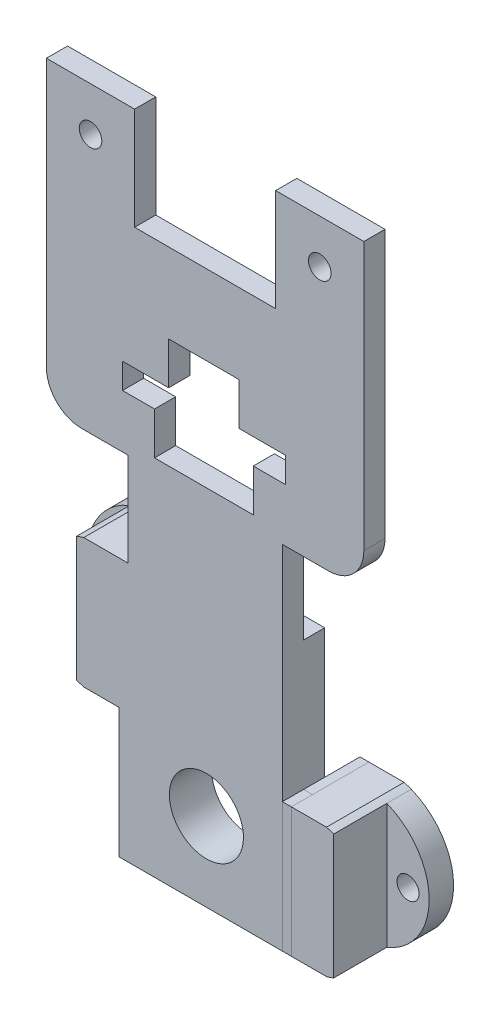
from build123d import *

# Parameters (mm, degrees)
BOSS_EXTRUDE1_DEPTH      = 17.806228865
BOSS_EXTRUDE2_DEPTH      = 3
SKETCH5_W                = 21.9
SKETCH5_H                = 3
BOSS_EXTRUDE3_DEPTH      = 37
CUT_EXTRUDE1_REACH       = 1273.855
SKETCH7_R                = 5.25
SKETCH8_W                = 3
SKETCH8_H                = 36.7
BOSS_EXTRUDE4_DEPTH      = 1.27
SKETCH9_W                = 3
SKETCH9_H                = 18.35
BOSS_EXTRUDE5_DEPTH      = 6
SKETCH11_W               = 6
SKETCH11_H               = 18.35
BOSS_EXTRUDE6_DEPTH      = 8
SKETCH12_W               = 6
SKETCH12_H               = 18.35
BOSS_EXTRUDE7_DEPTH      = 6
SKETCH14_R               = 1.5625
CUT_EXTRUDE2_DEPTH       = 1272.783249002
CUT_EXTRUDE3_DEPTH       = 1272.855217677
SKETCH17_R               = 1.6
CUT_EXTRUDE4_DEPTH       = 1272.855217677
SKETCH18_R               = 2.5
CUT_EXTRUDE5_DEPTH       = 3
FILLET8_R                = 2
SKETCH19_W               = 3
SKETCH19_H               = 18.35
BOSS_EXTRUDE9_DEPTH      = 1.27
SKETCH20_W               = 6
SKETCH20_H               = 18.35
BOSS_EXTRUDE10_DEPTH     = 11
SKETCH21_W               = 6
SKETCH21_H               = 18.35
BOSS_EXTRUDE12_DEPTH     = 6
SKETCH22_R               = 1.565
CUT_EXTRUDE6_DEPTH       = 1274.354061352
CUT_EXTRUDE7_DEPTH       = 1274.354061352
CUT_EXTRUDE7_DEPTH_BACK  = 1274.354061352
CUT_EXTRUDE11_DEPTH      = 1272.593907123
CUT_EXTRUDE11_DEPTH_BACK = 1272.593907123
SKETCH29_W               = 17.806228865
SKETCH29_H               = 21.127306801
CUT_EXTRUDE12_DEPTH      = 1271.750455843
CUT_EXTRUDE12_DEPTH_BACK = 1271.750455843
SKETCH30_W               = 45
SKETCH30_H               = 36.649004673
BOSS_EXTRUDE14_DEPTH     = 3
CUT_EXTRUDE13_DEPTH      = 1274.303470735
CUT_EXTRUDE13_DEPTH_BACK = 1274.303470735
CUT_EXTRUDE15_DEPTH      = 1274.303470735
CUT_EXTRUDE15_DEPTH_BACK = 1274.303470735
SKETCH35_W               = 20
SKETCH35_H               = 14.5
CUT_EXTRUDE16_DEPTH      = 1274.303470735
CUT_EXTRUDE16_DEPTH_BACK = 1274.303470735
SKETCH36_R               = 1.6
SKETCH37_W               = 21.9
SKETCH37_H               = 36.7
BOSS_EXTRUDE16_DEPTH     = 3
CUT_EXTRUDE17_DEPTH      = 1274.281087814
CUT_EXTRUDE17_DEPTH_BACK = 1274.281087814
SKETCH38_R               = 5.25
SKETCH39_W               = 21.9
SKETCH39_H               = 8
BOSS_EXTRUDE17_DEPTH     = 3
SKETCH40_W               = 8
SKETCH40_H               = 18.35
BOSS_EXTRUDE19_DEPTH     = 1.27
SKETCH41_W               = 8
SKETCH41_H               = 18.35
BOSS_EXTRUDE20_DEPTH     = 1.27
SKETCH42_W               = 7.54
SKETCH42_H               = 18.35
CUT_EXTRUDE18_DEPTH      = 1272.443848437
SKETCH43_W               = 7.54
SKETCH43_H               = 18.35
CUT_EXTRUDE19_DEPTH      = 1272.443848437


with BuildPart() as part:
    # Sketch1 → Boss-Extrude1 (new body)
    with BuildSketch(Plane(origin=(0, 0, 1119.483697074), x_dir=(-1, 0, 0), z_dir=(0, 0, -1))):
        with BuildLine():
            Line((-1161.329927858, 505.6656047), (-1161.329927858, 518.1656047))
            Line((-1161.329927858, 518.1656047), (-1148.829927858, 518.1656047))
            Line((-1148.829927858, 518.1656047), (-1148.829927858, 505.6656047))
            add(Edge.make_bspline(
                [(-1148.829927858, 505.6656047), (-1142.163261192, 505.6656047), (-1135.496594525, 505.6656047), (-1128.829927858, 505.6656047)],
                knots=[0.277777778, 0.277777778, 0.277777778, 0.277777778, 0.722222222, 0.722222222, 0.722222222, 0.722222222], degree=3))
            Line((-1128.829927858, 505.6656047), (-1128.829927858, 518.1656047))
            Line((-1128.829927858, 518.1656047), (-1116.329927858, 518.1656047))
            Line((-1116.329927858, 518.1656047), (-1116.329927858, 505.6656047))
            ThreePointArc((-1116.329927858, 505.6656047), (-1138.829927858, 497.038297899), (-1161.329927858, 505.6656047))
        make_face()
    extrude(amount=BOSS_EXTRUDE1_DEPTH)

    # Sketch4 → Boss-Extrude2 (add)
    with BuildSketch(Plane(origin=(0, 0, 1101.677468208), x_dir=(-1, 0, 0), z_dir=(0, 0, -1))):
        with BuildLine():
            Line((-1149.779927858, 462.266600027), (-1149.779927858, 489.392833753))
            ThreePointArc((-1149.779927858, 489.392833753), (-1152.708860047, 496.463901565), (-1159.779927858, 499.392833753))
            Line((-1159.779927858, 499.392833753), (-1161.329927858, 499.392833753))
            Line((-1161.329927858, 499.392833753), (-1161.329927858, 511.9156047))
            Line((-1161.329927858, 511.9156047), (-1116.329927858, 511.9156047))
            Line((-1116.329927858, 511.9156047), (-1116.329927858, 499.392833753))
            Line((-1116.329927858, 499.392833753), (-1117.879927858, 499.392833753))
            ThreePointArc((-1117.879927858, 499.392833753), (-1124.95099567, 496.463901565), (-1127.879927858, 489.392833753))
            Line((-1127.879927858, 489.392833753), (-1127.879927858, 462.266600027))
            Line((-1127.879927858, 462.266600027), (-1149.779927858, 462.266600027))
        make_face()
    extrude(amount=BOSS_EXTRUDE2_DEPTH)

    # Sketch5 → Boss-Extrude3 (add)
    with BuildSketch(Plane.XZ.offset(-462.266600027)):
        with Locations((1138.829927858, 1100.177468208)):
            Rectangle(SKETCH5_W, SKETCH5_H)
    extrude(amount=BOSS_EXTRUDE3_DEPTH)

    # Sketch7 → Cut-Extrude1 (cut, up to next)
    with BuildSketch(Plane(origin=(0, 0, 1098.677468208), x_dir=(-1, 0, 0), z_dir=(0, 0, -1)), mode=Mode.PRIVATE) as cut_extrude1_sk1:
        with Locations(Location((-1139.009861583, 436.459083359, 0), (0, 0, 90))):
            Circle(SKETCH7_R)
    cut_extrude1_tool1 = extrude(cut_extrude1_sk1.sketch, amount=-CUT_EXTRUDE1_REACH, mode=Mode.PRIVATE) & part.part
    add(cut_extrude1_tool1.solids().sort_by_distance((1139.009862, 436.459083, 1098.677468))[0], mode=Mode.SUBTRACT)



with BuildPart() as body_2:
    # Sketch8 → Boss-Extrude4 (new body)
    with BuildSketch(Plane.ZY.offset(-1127.879927858)):
        with Locations((1100.177468208, 443.616600027)):
            Rectangle(SKETCH8_W, SKETCH8_H)
    extrude(amount=BOSS_EXTRUDE4_DEPTH)


with BuildPart() as part_1:
    add(part.part)

    add(body_2.part)  # Boss-Extrude5 merges body 2
    # Sketch9 → Boss-Extrude5 (add)
    with BuildSketch(Plane.ZY.offset(-1126.609927858)):
        with Locations((1100.177468208, 452.791600027)):
            Rectangle(SKETCH9_W, SKETCH9_H)
    extrude(amount=BOSS_EXTRUDE5_DEPTH)

    # Sketch11 → Boss-Extrude6 (add)
    with BuildSketch(Plane.XY.offset(1101.677468208)):
        with Locations((1123.609927858, 452.791600027)):
            Rectangle(SKETCH11_W, SKETCH11_H)
    extrude(amount=BOSS_EXTRUDE6_DEPTH)

    # Sketch12 → Boss-Extrude7 (add)
    with BuildSketch(Plane.ZY.offset(-1120.609927858)):
        with Locations((1106.677468208, 452.791600027)):
            Rectangle(SKETCH12_W, SKETCH12_H)
    extrude(amount=BOSS_EXTRUDE7_DEPTH)

    # Sketch14 → Cut-Extrude2 (cut, through all)
    with BuildSketch(Plane(origin=(0, 0, 1103.677468208), x_dir=(-1, 0, 0), z_dir=(0, 0, -1))):
        with Locations((-1117.609927858, 452.791600027)):
            Circle(SKETCH14_R)
    extrude(amount=-CUT_EXTRUDE2_DEPTH, mode=Mode.SUBTRACT)

    # Sketch16 → Cut-Extrude3 (cut, through all)
    with BuildSketch(Plane(origin=(0, 0, 1098.677468208), x_dir=(-1, 0, 0), z_dir=(0, 0, -1))):
        with BuildLine():
            Line((-1126.609927858, 461.966600027), (-1126.609927858, 463.878724732))
            Line((-1126.609927858, 463.878724732), (-1111.609927858, 463.878724732))
            Line((-1111.609927858, 463.878724732), (-1111.609927858, 441.878724732))
            Line((-1111.609927858, 441.878724732), (-1126.609927858, 441.878724732))
            Line((-1126.609927858, 441.878724732), (-1126.609927858, 443.616600027))
            ThreePointArc((-1126.609927858, 443.616600027), (-1114.609927858, 452.791600027), (-1126.609927858, 461.966600027))
        make_face()
    extrude(amount=-CUT_EXTRUDE3_DEPTH, mode=Mode.SUBTRACT)

    # Sketch17 → Cut-Extrude4 (cut, through all)
    with BuildSketch(Plane(origin=(0, 0, 1098.677468208), x_dir=(-1, 0, 0), z_dir=(0, 0, -1))):
        with Locations(Location((-1122.579927858, 511.9156047, 0), (0, 0, 90))):
            Circle(SKETCH17_R)
        with Locations(Location((-1155.079927858, 511.9156047, 0), (0, 0, 90))):
            Circle(SKETCH17_R)
    extrude(amount=-CUT_EXTRUDE4_DEPTH, mode=Mode.SUBTRACT)

    # Sketch18 → Cut-Extrude5 (cut)
    with BuildSketch(Plane(origin=(0, 0, 1098.677468208), x_dir=(-1, 0, 0), z_dir=(0, 0, -1))):
        with Locations((-1155.079927858, 511.9156047)):
            Circle(SKETCH18_R)
        with Locations((-1122.579927858, 511.9156047)):
            Circle(SKETCH18_R)
    extrude(amount=-CUT_EXTRUDE5_DEPTH, mode=Mode.SUBTRACT)

    # Fillet8
    fillet8_edges = [part_1.edges().sort_by_distance(p)[0] for p in [
        (1138.829927858, 505.6656047, 1119.483697074),
    ]]
    fillet(fillet8_edges, radius=FILLET8_R)


with BuildPart() as body_2_2:
    # Sketch19 → Boss-Extrude9 (new body)
    with BuildSketch(Plane(origin=(1149.779927858, 0, 0), x_dir=(0, 0, -1), z_dir=(1, 0, 0))):
        with Locations((-1100.177468208, 434.441600027)):
            Rectangle(SKETCH19_W, SKETCH19_H)
    extrude(amount=BOSS_EXTRUDE9_DEPTH)


with BuildPart() as body_3:
    # Sketch20 → Boss-Extrude10 (new body)
    with BuildSketch(Plane(origin=(0, 0, 1098.677468208), x_dir=(-1, 0, 0), z_dir=(0, 0, -1))):
        with Locations((-1154.049927858, 434.441600027)):
            Rectangle(SKETCH20_W, SKETCH20_H)
    extrude(amount=-BOSS_EXTRUDE10_DEPTH)


with BuildPart() as body_4:
    # Sketch21 → Boss-Extrude12 (new body)
    with BuildSketch(Plane(origin=(1157.049927858, 0, 0), x_dir=(0, 0, -1), z_dir=(1, 0, 0))):
        with Locations((-1106.677468208, 434.441600027)):
            Rectangle(SKETCH21_W, SKETCH21_H)
    extrude(amount=BOSS_EXTRUDE12_DEPTH)

    # Sketch22 → Cut-Extrude6 (cut, through all)
    with BuildSketch(Plane(origin=(0, 0, 1103.677468208), x_dir=(-1, 0, 0), z_dir=(0, 0, -1))):
        with Locations((-1160.049927858, 434.441600027)):
            Circle(SKETCH22_R)
    extrude(amount=-CUT_EXTRUDE6_DEPTH, mode=Mode.SUBTRACT)


with BuildPart() as cut_extrude7_tool:
    # Sketch23 → Cut-Extrude7 (new, two sides: drawn at the far end of the back side and taken through both)
    with BuildSketch(Plane(origin=(0, 0, 1103.677468208), x_dir=(-1, 0, 0), z_dir=(0, 0, -1)).offset(-CUT_EXTRUDE7_DEPTH_BACK)):
        with BuildLine():
            Line((-1151.049927858, 425.266600027), (-1151.049927858, 419.441600027))
            Line((-1151.049927858, 419.441600027), (-1166.049927858, 419.441600027))
            Line((-1166.049927858, 419.441600027), (-1166.049927858, 449.441600027))
            Line((-1166.049927858, 449.441600027), (-1151.049927858, 449.441600027))
            Line((-1151.049927858, 449.441600027), (-1151.049927858, 443.616600027))
            ThreePointArc((-1151.049927858, 443.616600027), (-1163.049927858, 434.441600027), (-1151.049927858, 425.266600027))
        make_face()
    extrude(amount=CUT_EXTRUDE7_DEPTH + CUT_EXTRUDE7_DEPTH_BACK)


with BuildPart() as body_3_1:
    add(body_3.part)

    # Cut-Extrude7: cut by cut_extrude7_tool
    add(cut_extrude7_tool.part, mode=Mode.SUBTRACT)


with BuildPart() as body_4_1:
    add(body_4.part)

    # Cut-Extrude7: cut by cut_extrude7_tool
    add(cut_extrude7_tool.part, mode=Mode.SUBTRACT)


with BuildPart() as body_5:
    # Mirror4: mirrored copy
    add(part_1.part.mirror(Plane.XY.offset(1129.483697074)))

    # Sketch29 → Cut-Extrude11 (cut, two sides: drawn at the far end of the back side and taken through both)
    with BuildSketch(Plane(origin=(1161.329927858, 0, 0), x_dir=(0, 0, -1), z_dir=(1, 0, 0)).offset(-CUT_EXTRUDE11_DEPTH_BACK)):
        with Locations((-1148.386811507, 507.6019513)):
            Rectangle(SKETCH29_W, SKETCH29_H)
    extrude(amount=CUT_EXTRUDE11_DEPTH + CUT_EXTRUDE11_DEPTH_BACK, mode=Mode.SUBTRACT)

    # Sketch30 → Cut-Extrude12 (cut, two sides: drawn at the far end of the back side and taken through both)
    with BuildSketch(Plane(origin=(0, 0, 1157.289925939), x_dir=(-1, 0, 0), z_dir=(0, 0, -1)).offset(-CUT_EXTRUDE12_DEPTH_BACK)):
        with Locations((-1138.829927858, 493.591102363)):
            Rectangle(SKETCH30_W, SKETCH30_H)
    extrude(amount=CUT_EXTRUDE12_DEPTH + CUT_EXTRUDE12_DEPTH_BACK, mode=Mode.SUBTRACT)

    # Sketch32 → Boss-Extrude14 (add)
    with BuildSketch(Plane.XY.offset(1160.289925939)):
        with BuildLine():
            Line((1116.329927858, 518.1656047), (1116.329927858, 480.211710413))
            ThreePointArc((1116.329927858, 480.211710413), (1117.794393952, 476.676176507), (1121.329927858, 475.211710413))
            Line((1121.329927858, 475.211710413), (1156.329927858, 475.211710413))
            ThreePointArc((1156.329927858, 475.211710413), (1159.865461764, 476.676176507), (1161.329927858, 480.211710413))
            Line((1161.329927858, 480.211710413), (1161.329927858, 518.1656047))
            Line((1161.329927858, 518.1656047), (1116.329927858, 518.1656047))
        make_face()
    extrude(amount=-BOSS_EXTRUDE14_DEPTH)

    # Sketch33 → Cut-Extrude13 (cut, two sides: drawn at the far end of the back side and taken through both)
    with BuildSketch(Plane.XY.offset(1160.289925939).offset(-CUT_EXTRUDE13_DEPTH_BACK)):
        Polygon((1145.654927858, 476.7656047), (1131.654927858, 476.7656047), (1131.654927858, 482.7656047), (1127.114927858, 482.7656047), (1127.114927858, 486.3656047), (1133.654927858, 486.3656047), (1133.654927858, 492.3656047), (1143.654927858, 492.3656047), (1143.654927858, 486.3656047), (1150.194927858, 486.3656047), (1150.194927858, 482.7656047), (1145.654927858, 482.7656047), align=None)
    extrude(amount=CUT_EXTRUDE13_DEPTH + CUT_EXTRUDE13_DEPTH_BACK, mode=Mode.SUBTRACT)

    # Sketch35 → Cut-Extrude15 (cut, two sides: drawn at the far end of the back side and taken through both)
    with BuildSketch(Plane.XY.offset(1160.289925939).offset(-CUT_EXTRUDE15_DEPTH_BACK)):
        with Locations((1138.829927858, 510.9156047)):
            Rectangle(SKETCH35_W, SKETCH35_H)
    extrude(amount=CUT_EXTRUDE15_DEPTH + CUT_EXTRUDE15_DEPTH_BACK, mode=Mode.SUBTRACT)

    # Sketch36 → Cut-Extrude16 (cut, two sides: drawn at the far end of the back side and taken through both)
    with BuildSketch(Plane.XY.offset(1160.289925939).offset(-CUT_EXTRUDE16_DEPTH_BACK)):
        with Locations(Location((1122.579927858, 511.9156047, 0), (0, 0, 270))):
            Circle(SKETCH36_R)
        with Locations(Location((1155.079927858, 511.9156047, 0), (0, 0, 270))):
            Circle(SKETCH36_R)
    extrude(amount=CUT_EXTRUDE16_DEPTH + CUT_EXTRUDE16_DEPTH_BACK, mode=Mode.SUBTRACT)



with BuildPart() as body_6:
    # Mirror4 2: mirrored copy
    add(body_2_2.part.mirror(Plane.XY.offset(1129.483697074)))


with BuildPart() as body_7:
    # Mirror4 3: mirrored copy
    add(body_4_1.part.mirror(Plane.XY.offset(1129.483697074)))

    # Sketch43 → Cut-Extrude19 (cut, through all)
    with BuildSketch(Plane(origin=(1157.049927858, 0, 0), x_dir=(0, 0, -1), z_dir=(1, 0, 0))):
        with Locations((-1156.519925939, 434.441600027)):
            Rectangle(SKETCH43_W, SKETCH43_H)
    extrude(amount=CUT_EXTRUDE19_DEPTH, mode=Mode.SUBTRACT)


with BuildPart() as body_8:
    # Mirror4 4: mirrored copy
    add(body_3_1.part.mirror(Plane.XY.offset(1129.483697074)))


with BuildPart() as body_5_2:
    # Sketch37 → Boss-Extrude16 (new body)
    with BuildSketch(Plane(origin=(0, 0, 1157.289925939), x_dir=(-1, 0, 0), z_dir=(0, 0, -1))):
        with Locations((-1138.829927858, 443.616600027)):
            Rectangle(SKETCH37_W, SKETCH37_H)
    extrude(amount=BOSS_EXTRUDE16_DEPTH)

    # Sketch38 → Cut-Extrude17 (cut, two sides: drawn at the far end of the back side and taken through both)
    with BuildSketch(Plane.XY.offset(1157.289925939).offset(-CUT_EXTRUDE17_DEPTH_BACK)):
        with Locations(Location((1139.009861583, 436.459083359, 0), (0, 0, 90))):
            Circle(SKETCH38_R)
    extrude(amount=CUT_EXTRUDE17_DEPTH + CUT_EXTRUDE17_DEPTH_BACK, mode=Mode.SUBTRACT)


with BuildPart() as body_5_1:
    add(body_5.part)

    add(body_5_2.part)  # Boss-Extrude17 merges body 5 2
    # Sketch39 → Boss-Extrude17 (add)
    with BuildSketch(Plane.XZ.offset(-425.266600027)):
        with Locations((1138.829927858, 1153.289925939)):
            Rectangle(SKETCH39_W, SKETCH39_H)
    extrude(amount=BOSS_EXTRUDE17_DEPTH)

    # Sketch42 → Cut-Extrude18 (cut, through all)
    with BuildSketch(Plane.ZY.offset(-1120.609927858)):
        with Locations((1156.519925939, 452.791600027)):
            Rectangle(SKETCH42_W, SKETCH42_H)
    extrude(amount=CUT_EXTRUDE18_DEPTH, mode=Mode.SUBTRACT)


with BuildPart() as body_5_3:
    # Sketch40 → Boss-Extrude19 (new body)
    with BuildSketch(Plane.ZY.offset(-1151.049927858)):
        with Locations((1153.289925939, 434.441600027)):
            Rectangle(SKETCH40_W, SKETCH40_H)
    extrude(amount=BOSS_EXTRUDE19_DEPTH)


with BuildPart() as body_6_2:
    # Sketch41 → Boss-Extrude20 (new body)
    with BuildSketch(Plane(origin=(1126.609927858, 0, 0), x_dir=(0, 0, -1), z_dir=(1, 0, 0))):
        with Locations((-1153.289925939, 452.791600027)):
            Rectangle(SKETCH41_W, SKETCH41_H)
    extrude(amount=BOSS_EXTRUDE20_DEPTH)


solid = Compound([body_6.part, body_7.part, body_8.part, body_5_1.part, body_5_3.part, body_6_2.part])
